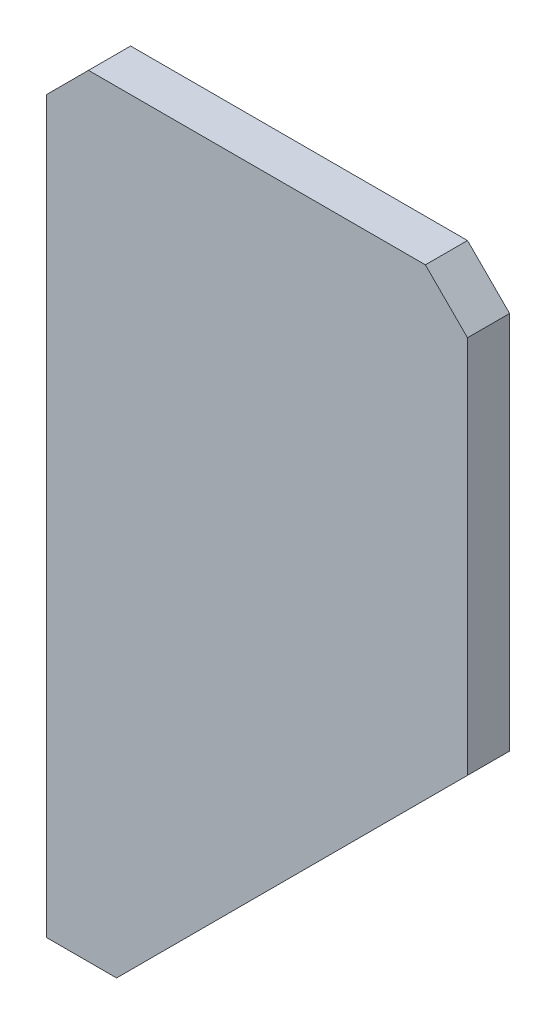
from build123d import *

# Parameters (mm, degrees)
SKETCH1_W           = 30
SKETCH1_H           = 55
BOSS_EXTRUDE1_DEPTH = 1.5
CHAMFER1_SIZE       = 3
CHAMFER2_SIZE       = 25


with BuildPart() as part:
    # Sketch1 → Boss-Extrude1 (new, symmetric)
    with BuildSketch(Plane.XY):
        Rectangle(SKETCH1_W, SKETCH1_H)
    extrude(amount=BOSS_EXTRUDE1_DEPTH, both=True)

    # Chamfer1
    chamfer1_edges = [part.edges().sort_by_distance(p)[0] for p in [
        (-15, 27.5, 0),
        (15, 27.5, 0),
    ]]
    chamfer(chamfer1_edges, length=CHAMFER1_SIZE)

    # Chamfer2
    chamfer2_edges = [part.edges().sort_by_distance(p)[0] for p in [
        (15, -27.5, 0),
    ]]
    chamfer(chamfer2_edges, length=CHAMFER2_SIZE)


solid = part.part
